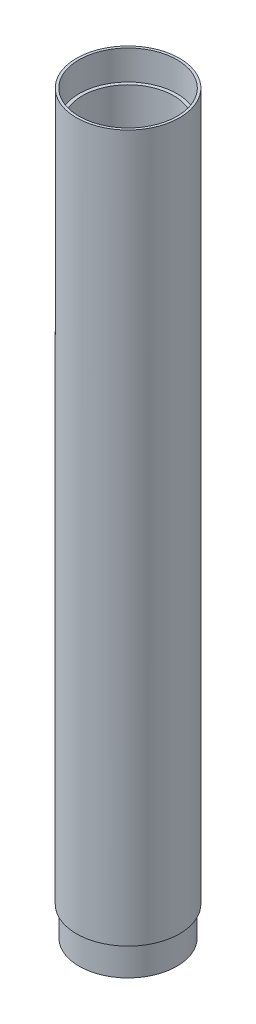
from build123d import *

# Parameters (mm, degrees)
SKETCH1_R           = 17.5
SKETCH1_R_2         = 15.5
BOSS_EXTRUDE1_DEPTH = 240
SKETCH2_R           = 17.5
SKETCH2_R_2         = 16.65
BOSS_EXTRUDE2_DEPTH = 10
SKETCH3_R           = 17.5
SKETCH3_R_2         = 16.6
CUT_EXTRUDE1_DEPTH  = 10


with BuildPart() as part:
    # Sketch1 → Boss-Extrude1 (new body)
    with BuildSketch(Plane(origin=(0, 0, 0), x_dir=(1, 0, 0), z_dir=(0, 1, 0))):
        with Locations(Location((0, 0, 0), (0, 0, 270))):
            Circle(SKETCH1_R)
        with Locations(Location((0, 0, 0), (0, 0, 270))):
            Circle(SKETCH1_R_2, mode=Mode.SUBTRACT)
    extrude(amount=BOSS_EXTRUDE1_DEPTH)

    # Sketch2 → Boss-Extrude2 (add)
    with BuildSketch(Plane(origin=(0, 240, 0), x_dir=(1, 0, 0), z_dir=(0, 1, 0))):
        with Locations(Location((0, 0, 0), (0, 0, 270))):
            Circle(SKETCH2_R)
        with Locations(Location((0, 0, 0), (0, 0, 270))):
            Circle(SKETCH2_R_2, mode=Mode.SUBTRACT)
    extrude(amount=BOSS_EXTRUDE2_DEPTH)

    # Sketch3 → Cut-Extrude1 (cut)
    with BuildSketch(Plane.XZ):
        with Locations(Location((0, 0, 0), (0, 0, 270))):
            Circle(SKETCH3_R)
        with Locations(Location((0, 0, 0), (0, 0, 270))):
            Circle(SKETCH3_R_2, mode=Mode.SUBTRACT)
    extrude(amount=-CUT_EXTRUDE1_DEPTH, mode=Mode.SUBTRACT)


solid = part.part
